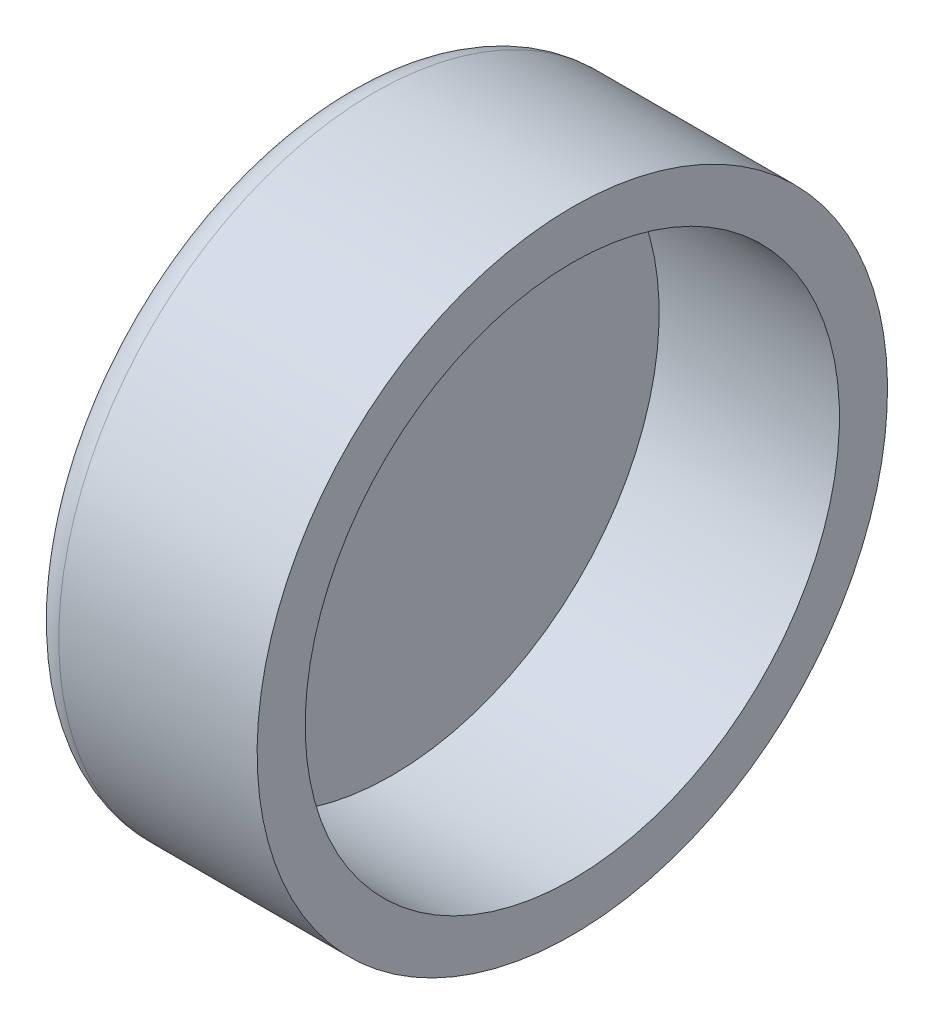
from build123d import *

# Parameters (mm, degrees)
REDONDEO1_R = 5


with BuildPart() as part:
    # Croquis2 → Revolución1 (revolve)
    with BuildSketch(Plane.XY):
        Polygon((0, 44.45), (-30, 44.45), (-30, 0), (-38, 0), (-38, 52.45), (0, 52.45), align=None)
    revolve(axis=Axis((-30, 0, 0), (-1, 0, 0)))

    # Redondeo1
    redondeo1_edges = [part.edges().sort_by_distance(p)[0] for p in [
        (-38, -52.45, 0),
    ]]
    fillet(redondeo1_edges, radius=REDONDEO1_R)


solid = part.part
